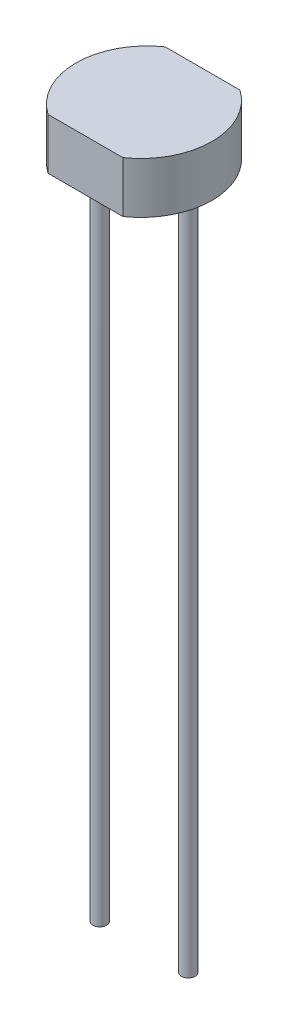
from build123d import *

# Parameters (mm, degrees)
BOSS_EXTRUDE1_DEPTH = 1.905
SKETCH2_R           = 0.254
BOSS_EXTRUDE2_DEPTH = 25.4


with BuildPart() as part:
    # Sketch1 → Boss-Extrude1 (new body)
    with BuildSketch(Plane(origin=(0, 0, 0), x_dir=(1, 0, 0), z_dir=(0, 1, 0))):
        with BuildLine():
            Line((-1.397, 2.1844), (1.397, 2.1844))
            ThreePointArc((1.397, 2.1844), (2.54, 0), (1.397, -2.1844))
            Line((1.397, -2.1844), (-1.397, -2.1844))
            ThreePointArc((-1.397, -2.1844), (-2.54, 0), (-1.397, 2.1844))
        make_face()
    extrude(amount=BOSS_EXTRUDE1_DEPTH)

    # Sketch2 → Boss-Extrude2 (add)
    with BuildSketch(Plane.XZ):
        with Locations(Location((-1.651, 0, 0), (0, 0, 90))):
            Circle(SKETCH2_R)
        with Locations(Location((1.651, 0, 0), (0, 0, 90))):
            Circle(SKETCH2_R)
    extrude(amount=BOSS_EXTRUDE2_DEPTH)


solid = part.part
